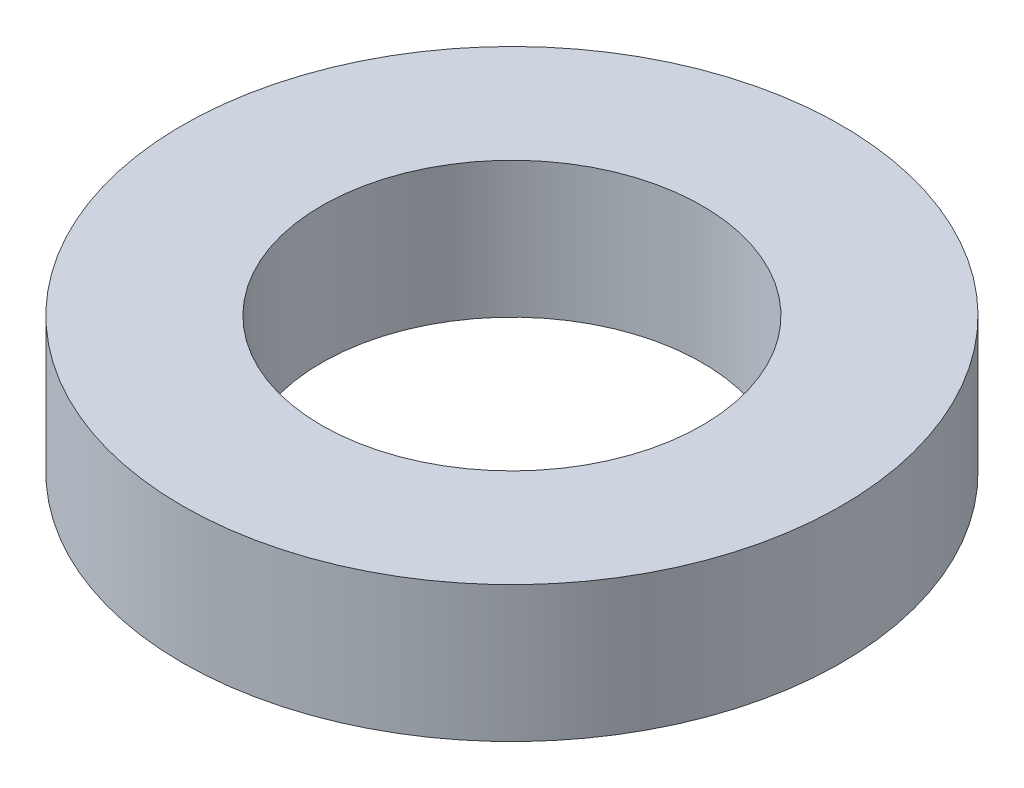
from build123d import *

# Parameters (mm, degrees)
O_RING_START = -1
SKETCH1_R    = 4.85
SKETCH1_R_2  = 2.8
O_RING_DEPTH = 2


with BuildPart() as part:
    # Sketch1 → O_Ring (new body)
    with BuildSketch(Plane(origin=(0, 0, 0), x_dir=(1, 0, 0), z_dir=(0, 1, 0)).offset(O_RING_START)):
        with Locations(Location((0, 0, 0), (0, 0, 270))):
            Circle(SKETCH1_R)
        with Locations(Location((0, 0, 0), (0, 0, 270))):
            Circle(SKETCH1_R_2, mode=Mode.SUBTRACT)
    extrude(amount=O_RING_DEPTH)


solid = part.part
